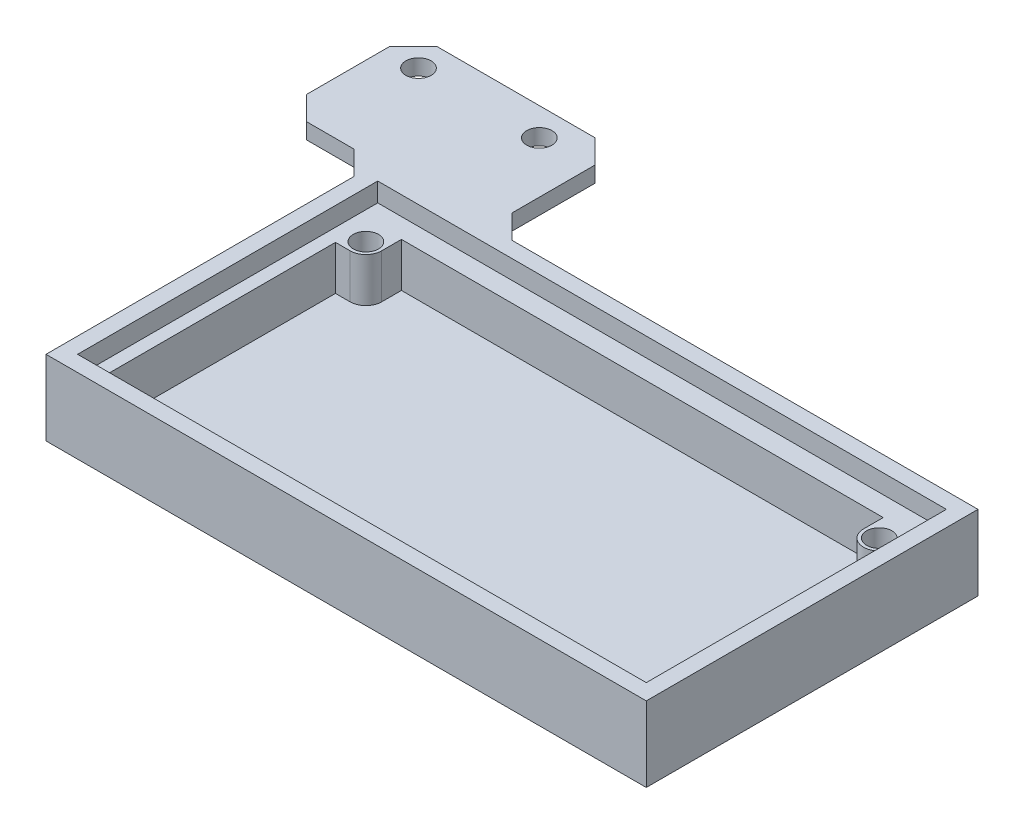
from build123d import *

# Parameters (mm, degrees)
SKETCH1_W               = 76
SKETCH1_H               = 42
SKETCH1_W_2             = 72
SKETCH1_H_2             = 38
BOSS_EXTRUDE1_DEPTH     = 8
SKETCH2_W               = 76
SKETCH2_H               = 42
BOSS_EXTRUDE2_DEPTH     = 1.5
BOSS_EXTRUDE3_START     = -2.4
BOSS_EXTRUDE3_DEPTH     = 7.1
SKETCH4_R               = 1.6
CUT_EXTRUDE1_DEPTH      = 10
SKETCH6_W               = 26
SKETCH6_H               = 2
BOSS_EXTRUDE4_DEPTH     = 16.5
CHAMFER1_SIZE           = 3
CHAMFER2_SIZE           = 3
CUT_EXTRUDE2_DEPTH      = 64.217877218
CUT_EXTRUDE2_DEPTH_BACK = 64.217877218
SKETCH7_R               = 1.6
CHAMFER3_SIZE           = 3


with BuildPart() as part:
    # Sketch1 → Boss-Extrude1 (new body)
    with BuildSketch(Plane(origin=(0, 0, 0), x_dir=(1, 0, 0), z_dir=(0, 1, 0))):
        Rectangle(SKETCH1_W, SKETCH1_H)
        Rectangle(SKETCH1_W_2, SKETCH1_H_2, mode=Mode.SUBTRACT)
    extrude(amount=BOSS_EXTRUDE1_DEPTH)

    # Sketch2 → Boss-Extrude2 (add)
    with BuildSketch(Plane.XZ):
        Rectangle(SKETCH2_W, SKETCH2_H)
    extrude(amount=BOSS_EXTRUDE2_DEPTH)

    # Sketch3 → Boss-Extrude3 (add)
    with BuildSketch(Plane(origin=(0, 8, 0), x_dir=(1, 0, 0), z_dir=(0, 1, 0)).offset(BOSS_EXTRUDE3_START)):
        Polygon((-36, 19), (-36, 16.5), (-34.35, 16.5), (-30.5, 16.5), (30.5, 16.5), (34.35, 16.5), (36, 16.5), (36, 19), align=None)
        with BuildLine():
            Line((-34.35, 16.5), (-36, 16.5))
            Line((-36, 16.5), (-36, -19))
            Line((-36, -19), (-34.35, -19))
            Line((-34.35, -19), (-34.35, 12))
            Line((-34.35, 12), (-34.35, 13.240065792))
            ThreePointArc((-34.35, 13.240065792), (-34.5, 14), (-34.35, 14.759934208))
            Line((-34.35, 14.759934208), (-34.35, 16.5))
        make_face()
        with BuildLine():
            Line((-30.5, 16.5), (-34.35, 16.5))
            Line((-34.35, 16.5), (-34.35, 14.759934208))
            ThreePointArc((-34.35, 14.759934208), (-32.112701665, 15.962141687), (-30.5, 14))
            Line((-30.5, 14), (-30.5, 16.5))
        make_face()
        with BuildLine():
            ThreePointArc((-32.5, 12), (-33.613582414, 12.338695029), (-34.35, 13.240065792))
            Line((-34.35, 13.240065792), (-34.35, 12))
            Line((-34.35, 12), (-32.5, 12))
        make_face()
        with BuildLine():
            ThreePointArc((-30.5, 14), (-32.112701665, 15.962141687), (-34.35, 14.759934208))
            Line((-34.35, 14.759934208), (-34.35, 13.240065792))
            ThreePointArc((-34.35, 13.240065792), (-33.613582414, 12.338695029), (-32.5, 12))
            ThreePointArc((-32.5, 12), (-31.085786438, 12.585786438), (-30.5, 14))
        make_face()
        with BuildLine():
            Line((-34.35, 13.240065792), (-34.35, 14.759934208))
            ThreePointArc((-34.35, 14.759934208), (-34.5, 14), (-34.35, 13.240065792))
        make_face()
        with BuildLine():
            ThreePointArc((34.35, 14.759934208), (32.112701665, 15.962141687), (30.5, 14))
            ThreePointArc((30.5, 14), (31.085786438, 12.585786438), (32.5, 12))
            ThreePointArc((32.5, 12), (33.613582414, 12.338695029), (34.35, 13.240065792))
            Line((34.35, 13.240065792), (34.35, 14.759934208))
        make_face()
        with BuildLine():
            ThreePointArc((34.5, 14), (34.462141687, 14.387298335), (34.35, 14.759934208))
            Line((34.35, 14.759934208), (34.35, 13.240065792))
            ThreePointArc((34.35, 13.240065792), (34.462141687, 13.612701665), (34.5, 14))
        make_face()
        with BuildLine():
            Line((34.35, 16.5), (30.5, 16.5))
            Line((30.5, 16.5), (30.5, 14))
            ThreePointArc((30.5, 14), (32.112701665, 15.962141687), (34.35, 14.759934208))
            Line((34.35, 14.759934208), (34.35, 16.5))
        make_face()
        with BuildLine():
            Line((36, -19), (36, 16.5))
            Line((36, 16.5), (34.35, 16.5))
            Line((34.35, 16.5), (34.35, 14.759934208))
            ThreePointArc((34.35, 14.759934208), (34.462141687, 14.387298335), (34.5, 14))
            ThreePointArc((34.5, 14), (34.462141687, 13.612701665), (34.35, 13.240065792))
            Line((34.35, 13.240065792), (34.35, 12))
            Line((34.35, 12), (34.35, -19))
            Line((34.35, -19), (36, -19))
        make_face()
    extrude(amount=-BOSS_EXTRUDE3_DEPTH)

    # Sketch4 → Cut-Extrude1 (cut)
    with BuildSketch(Plane(origin=(0, 5.6, 0), x_dir=(1, 0, 0), z_dir=(0, 1, 0))):
        with Locations(Location((32.5, 14, 0), (0, 0, 270))):
            Circle(SKETCH4_R)
        with Locations(Location((-32.5, 14, 0), (0, 0, 270))):
            Circle(SKETCH4_R)
    extrude(amount=-CUT_EXTRUDE1_DEPTH, mode=Mode.SUBTRACT)

    # Sketch6 → Boss-Extrude4 (add)
    with BuildSketch(Plane(origin=(0, 0, -21), x_dir=(-1, 0, 0), z_dir=(0, 0, -1))):
        with Locations((37, 7)):
            Rectangle(SKETCH6_W, SKETCH6_H)
    extrude(amount=BOSS_EXTRUDE4_DEPTH)

    # Chamfer1
    chamfer1_edges = [part.edges().sort_by_distance(p)[0] for p in [
        (-31, 6, -21),
    ]]
    chamfer(chamfer1_edges, length=CHAMFER1_SIZE)

    # Chamfer2
    chamfer2_edges = [part.edges().sort_by_distance(p)[0] for p in [
        (-24, 5.5, -21),
        (-24, 7, -37.5),
        (-50, 7, -37.5),
        (-50, 7, -21),
    ]]
    chamfer(chamfer2_edges, length=CHAMFER2_SIZE)

    # Sketch7 → Cut-Extrude2 (cut, two sides: drawn at the far end of the back side and taken through both)
    with BuildSketch(Plane(origin=(0, 8, 0), x_dir=(1, 0, 0), z_dir=(0, 1, 0)).offset(-CUT_EXTRUDE2_DEPTH_BACK)):
        with Locations(Location((-30.5, 33.96, 0), (0, 0, 270))):
            Circle(SKETCH7_R)
        with Locations(Location((-45.8, 33.96, 0), (0, 0, 270))):
            Circle(SKETCH7_R)
    extrude(amount=CUT_EXTRUDE2_DEPTH + CUT_EXTRUDE2_DEPTH_BACK, mode=Mode.SUBTRACT)

    # Chamfer3
    chamfer3_edges = [part.edges().sort_by_distance(p)[0] for p in [
        (-38, 7, -21),
    ]]
    chamfer(chamfer3_edges, length=CHAMFER3_SIZE)


solid = part.part
